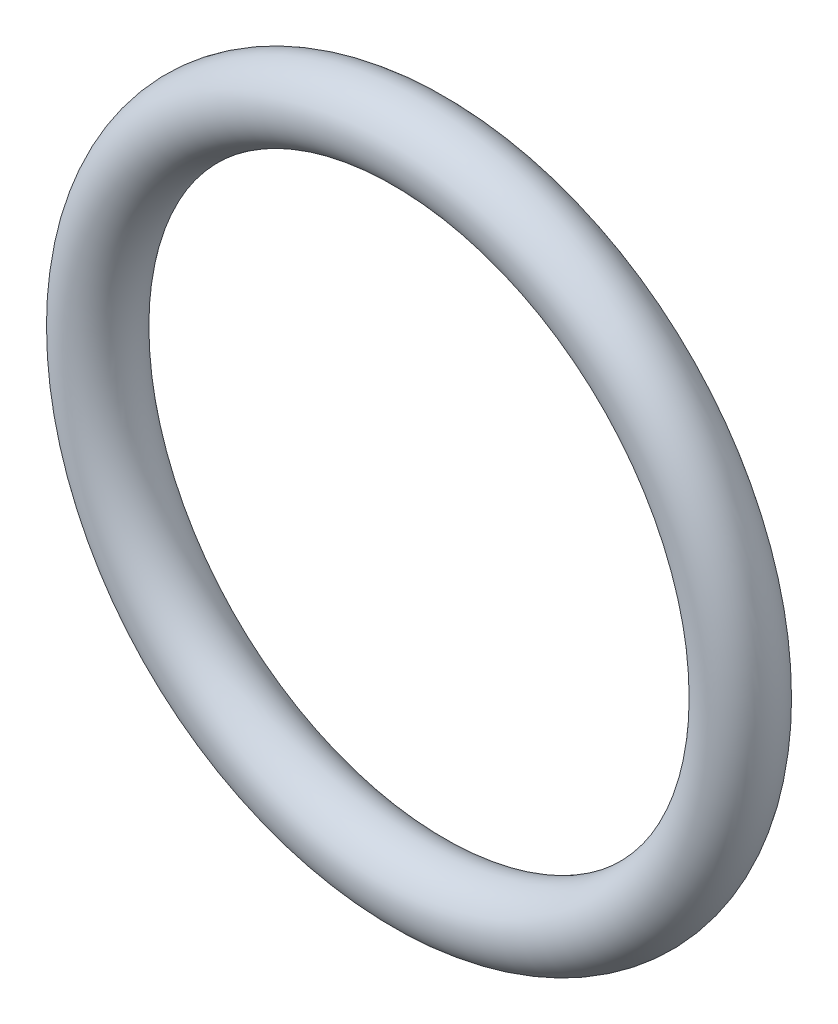
from build123d import *

# Parameters (mm, degrees)
SKETCH1_R = 0.889


with BuildPart() as part:
    # Sketch1 → Revolve1 (revolve)
    with BuildSketch(Plane(origin=(0, 0, 0), x_dir=(0, 0, -1), z_dir=(1, 0, 0)), mode=Mode.PRIVATE) as revolve1_sk:
        with Locations((0, 7.8867)):
            Circle(SKETCH1_R)
    revolve(revolve1_sk.sketch.rotate(Axis((0, 0, 7.451954658), (0, 0, -1)), 90), axis=Axis((0, 0, 7.451954658), (0, 0, -1)))


solid = part.part
